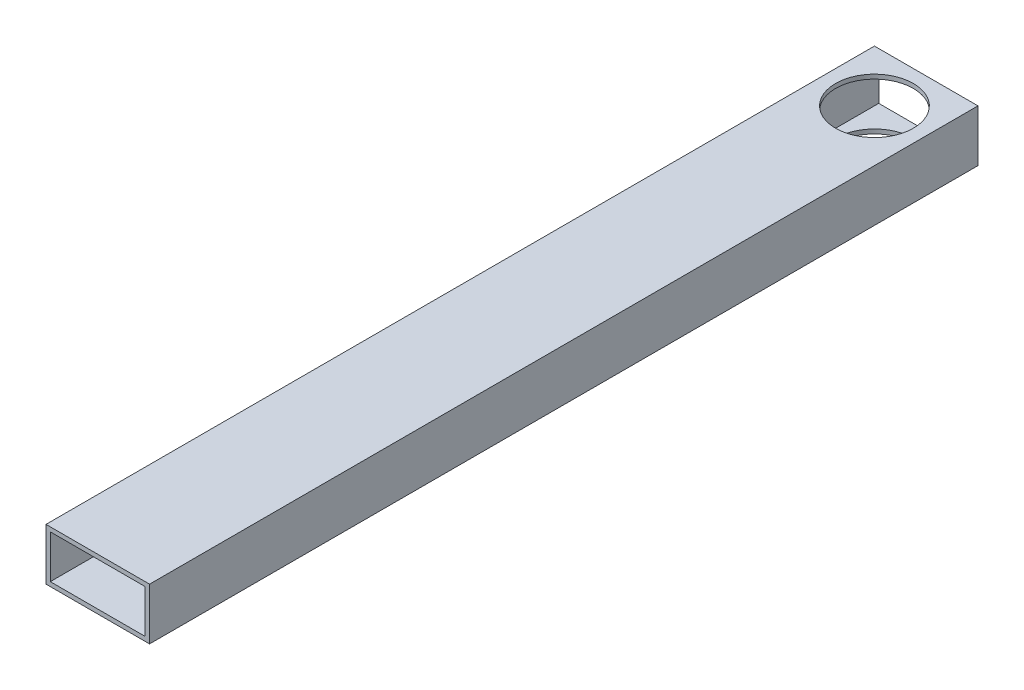
from build123d import *

# Parameters (mm, degrees)
SKETCH1_W           = 38.1
SKETCH1_H           = 19.05
SKETCH1_W_2         = 34.925
SKETCH1_H_2         = 15.875
EXTRUDE_THIN1_DEPTH = 304.8
SKETCH3_R           = 14.2875
CUT_EXTRUDE2_DEPTH  = 308.762168728


with BuildPart() as part:
    # Sketch1 → Extrude-Thin1 (new body)
    with BuildSketch(Plane.XY):
        with Locations((19.05, 9.525)):
            Rectangle(SKETCH1_W, SKETCH1_H)
        with Locations((19.05, 9.525)):
            Rectangle(SKETCH1_W_2, SKETCH1_H_2, mode=Mode.SUBTRACT)
    extrude(amount=EXTRUDE_THIN1_DEPTH)

    # Sketch3 → Cut-Extrude2 (cut, through all)
    with BuildSketch(Plane.XZ):
        with Locations(Location((19.05, 19.05, 0), (0, 0, 270))):
            Circle(SKETCH3_R)
    extrude(amount=-CUT_EXTRUDE2_DEPTH, mode=Mode.SUBTRACT)


solid = part.part
